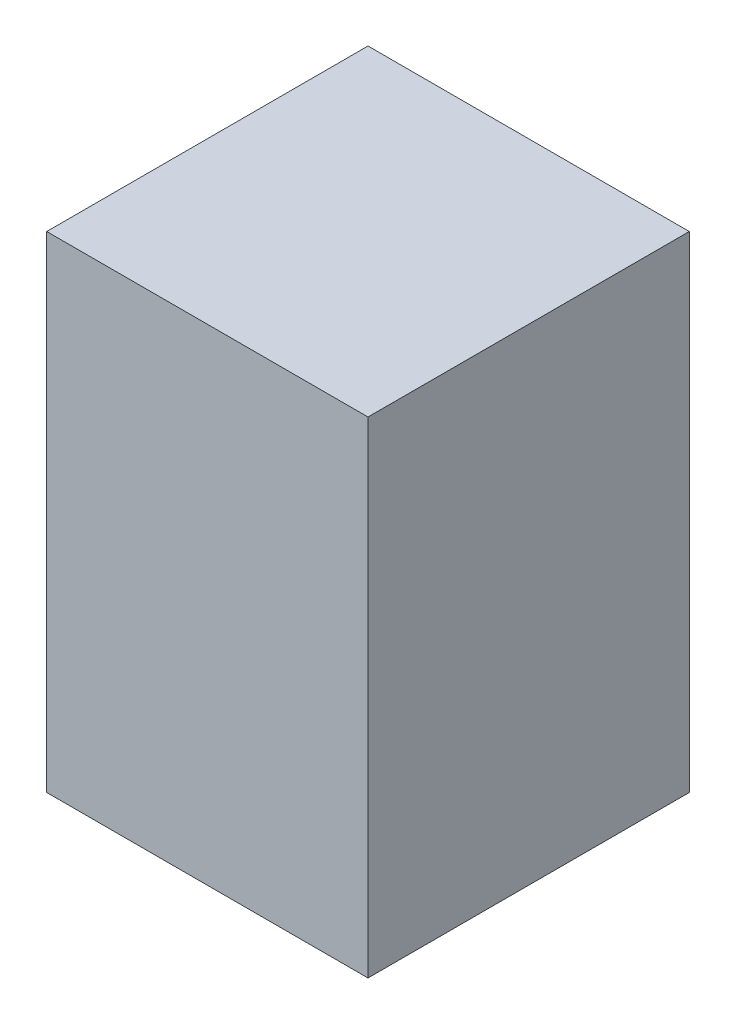
from build123d import *

# Parameters (mm, degrees)
SKETCH_1_W      = 82
SKETCH_1_H      = 82
EXTRUDE_1_DEPTH = 124


with BuildPart() as part:
    # 스케치1 → 보스-돌출1 (new body)
    with BuildSketch(Plane(origin=(0, 0, 0), x_dir=(1, 0, 0), z_dir=(0, 1, 0))):
        Rectangle(SKETCH_1_W, SKETCH_1_H)
    extrude(amount=EXTRUDE_1_DEPTH)


solid = part.part
